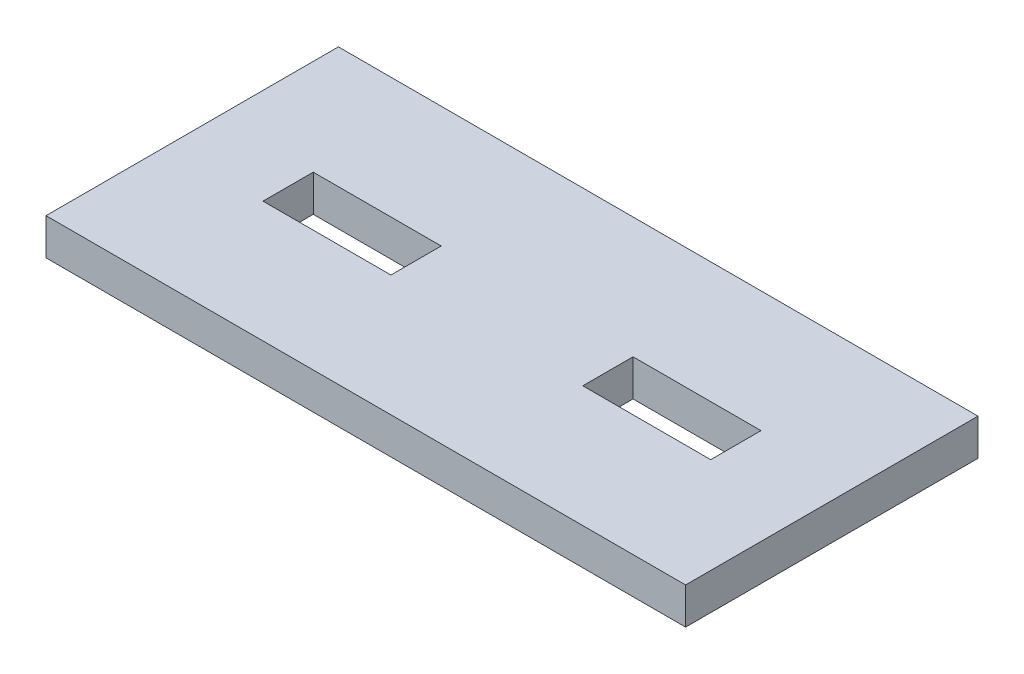
from build123d import *

# Parameters (mm, degrees)
SKETCH1_W                     = 70
SKETCH1_H                     = 32
SKETCH1_W_2                   = 14
SKETCH1_H_2                   = 5.5
SLOTTED_BRACKET_EXTRUDE_DEPTH = 4


with BuildPart() as part:
    # Sketch1 → Slotted_Bracket_Extrude (new body)
    with BuildSketch(Plane(origin=(0, 0, 0), x_dir=(1, 0, 0), z_dir=(0, 1, 0))):
        Rectangle(SKETCH1_W, SKETCH1_H)
        with Locations((-17.5, 0)):
            Rectangle(SKETCH1_W_2, SKETCH1_H_2, mode=Mode.SUBTRACT)
        with Locations((17.5, 0)):
            Rectangle(SKETCH1_W_2, SKETCH1_H_2, mode=Mode.SUBTRACT)
    extrude(amount=SLOTTED_BRACKET_EXTRUDE_DEPTH)


solid = part.part
